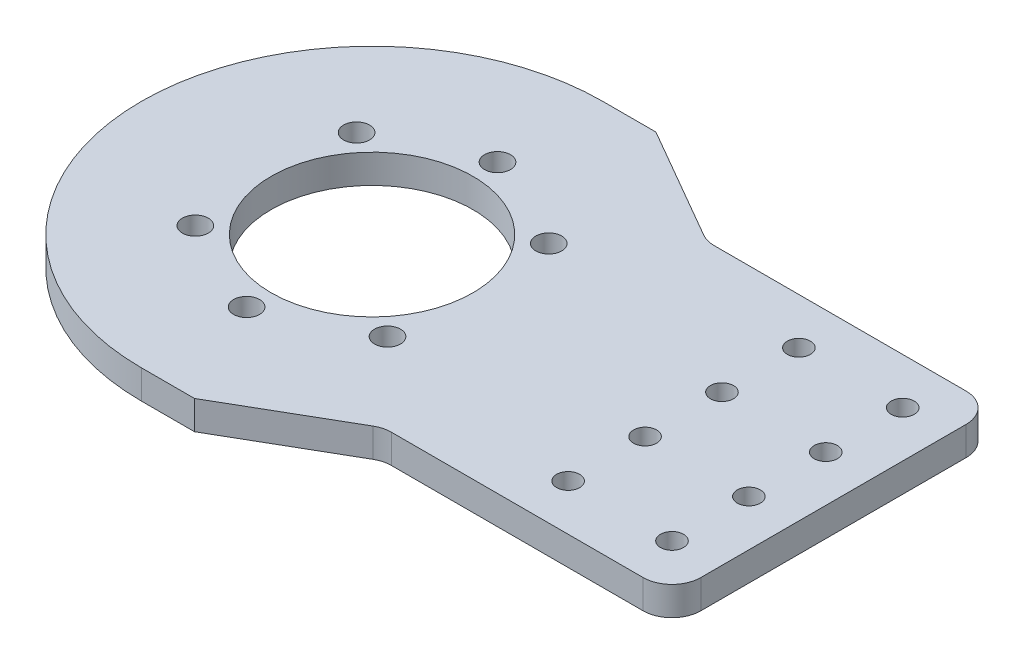
from build123d import *

# Parameters (mm, degrees)
SKETCH_1_W          = 270
SKETCH_1_H          = 5
EXTRUDE_1_DEPTH     = 95
SKETCH_2_R          = 2.25
SKETCH_2_R_2        = 17.5
CUT_EXTRUDE_1_DEPTH = 10
SKETCH_3_W          = 70
SKETCH_3_H          = 20
CUT_EXTRUDE_2_DEPTH = 10
SKETCH_6_W          = 219.864116777
SKETCH_6_H          = 129.686347052
CUT_EXTRUDE_5_DEPTH = 10
SKETCH_7_W          = 55.982845341
SKETCH_7_H          = 55
EXTRUDE_1_2_DEPTH   = 5
SKETCH_9_R          = 2
CUT_EXTRUDE_6_DEPTH = 5
FILLET_1_R          = 5
CUT_EXTRUDE_START   = -5
CUT_EXTRUDE_7_DEPTH = 5
FILLET_2_R          = 5


with BuildPart() as part:
    # 草图1 → Extrude 1 (new body)
    with BuildSketch(Plane.XY):
        with Locations((-135, -2.5)):
            Rectangle(SKETCH_1_W, SKETCH_1_H)
    extrude(amount=EXTRUDE_1_DEPTH)

    # 草图2 → 切除-拉伸1 (cut)
    with BuildSketch(Plane(origin=(0, 0, 0), x_dir=(1, 0, 0), z_dir=(0, 1, 0))):
        with Locations(Location((-246, -25.75, 0), (0, 0, 270))):
            Circle(SKETCH_2_R)
        with Locations(Location((-229.338533362, -33.519369489, 0), (0, 0, 270))):
            Circle(SKETCH_2_R)
        with Locations(Location((-262.661466638, -33.519369489, 0), (0, 0, 270))):
            Circle(SKETCH_2_R)
        with Locations(Location((-262.661466638, -61.480630511, 0), (0, 0, 270))):
            Circle(SKETCH_2_R)
        with Locations(Location((-246, -69.25, 0), (0, 0, 270))):
            Circle(SKETCH_2_R)
        with Locations(Location((-229.338533362, -61.480630511, 0), (0, 0, 270))):
            Circle(SKETCH_2_R)
        with Locations(Location((-246, -47.5, 0), (0, 0, 270))):
            Circle(SKETCH_2_R_2)
    extrude(amount=-CUT_EXTRUDE_1_DEPTH, mode=Mode.SUBTRACT)

    # 草图3 → 切除-拉伸2 (cut)
    with BuildSketch(Plane(origin=(0, 0, 0), x_dir=(1, 0, 0), z_dir=(0, 1, 0))):
        with Locations((-235, -85)):
            Rectangle(SKETCH_3_W, SKETCH_3_H)
        with Locations((-235, -10)):
            Rectangle(SKETCH_3_W, SKETCH_3_H)
        with BuildLine():
            Line((-190, -10), (-190, -34.757359313))
            ThreePointArc((-190, -34.757359313), (-188.148050297, -37.52899791), (-184.878679656, -36.878679656))
            Line((-184.878679656, -36.878679656), (-160.121320344, -12.121320344))
            ThreePointArc((-160.121320344, -12.121320344), (-159.47100209, -8.851949703), (-162.242640687, -7))
            Line((-162.242640687, -7), (-187, -7))
            ThreePointArc((-187, -7), (-189.121320344, -7.878679656), (-190, -10))
        make_face()
        with BuildLine():
            Line((-154.121320344, -12.121320344), (-178.878679656, -36.878679656))
            ThreePointArc((-178.878679656, -36.878679656), (-179.52899791, -40.148050297), (-176.757359313, -42))
            Line((-176.757359313, -42), (-152, -42))
            ThreePointArc((-152, -42), (-149.878679656, -41.121320344), (-149, -39))
            Line((-149, -39), (-149, -14.242640687))
            ThreePointArc((-149, -14.242640687), (-150.851949703, -11.47100209), (-154.121320344, -12.121320344))
        make_face()
        with BuildLine():
            Line((-112.242640687, -7), (-137, -7))
            ThreePointArc((-137, -7), (-139.121320344, -7.878679656), (-140, -10))
            Line((-140, -10), (-140, -34.757359313))
            ThreePointArc((-140, -34.757359313), (-138.148050297, -37.52899791), (-134.878679656, -36.878679656))
            Line((-134.878679656, -36.878679656), (-110.121320344, -12.121320344))
            ThreePointArc((-110.121320344, -12.121320344), (-109.47100209, -8.851949703), (-112.242640687, -7))
        make_face()
        with BuildLine():
            Line((-99, -39), (-99, -14.242640687))
            ThreePointArc((-99, -14.242640687), (-100.851949703, -11.47100209), (-104.121320344, -12.121320344))
            Line((-104.121320344, -12.121320344), (-128.878679656, -36.878679656))
            ThreePointArc((-128.878679656, -36.878679656), (-129.52899791, -40.148050297), (-126.757359313, -42))
            Line((-126.757359313, -42), (-102, -42))
            ThreePointArc((-102, -42), (-99.878679656, -41.121320344), (-99, -39))
        make_face()
        with BuildLine():
            Line((-112.242640687, -52), (-137, -52))
            ThreePointArc((-137, -52), (-139.121320344, -52.878679656), (-140, -55))
            Line((-140, -55), (-140, -79.757359313))
            ThreePointArc((-140, -79.757359313), (-138.148050297, -82.52899791), (-134.878679656, -81.878679656))
            Line((-134.878679656, -81.878679656), (-110.121320344, -57.121320344))
            ThreePointArc((-110.121320344, -57.121320344), (-109.47100209, -53.851949703), (-112.242640687, -52))
        make_face()
        with BuildLine():
            Line((-99, -84), (-99, -59.242640687))
            ThreePointArc((-99, -59.242640687), (-100.851949703, -56.47100209), (-104.121320344, -57.121320344))
            Line((-104.121320344, -57.121320344), (-128.878679656, -81.878679656))
            ThreePointArc((-128.878679656, -81.878679656), (-129.52899791, -85.148050297), (-126.757359313, -87))
            Line((-126.757359313, -87), (-102, -87))
            ThreePointArc((-102, -87), (-99.878679656, -86.121320344), (-99, -84))
        make_face()
        with BuildLine():
            Line((-162.242640687, -52), (-187, -52))
            ThreePointArc((-187, -52), (-189.121320344, -52.878679656), (-190, -55))
            Line((-190, -55), (-190, -79.757359313))
            ThreePointArc((-190, -79.757359313), (-188.148050297, -82.52899791), (-184.878679656, -81.878679656))
            Line((-184.878679656, -81.878679656), (-160.121320344, -57.121320344))
            ThreePointArc((-160.121320344, -57.121320344), (-159.47100209, -53.851949703), (-162.242640687, -52))
        make_face()
        with BuildLine():
            Line((-149, -84), (-149, -59.242640687))
            ThreePointArc((-149, -59.242640687), (-150.851949703, -56.47100209), (-154.121320344, -57.121320344))
            Line((-154.121320344, -57.121320344), (-178.878679656, -81.878679656))
            ThreePointArc((-178.878679656, -81.878679656), (-179.52899791, -85.148050297), (-176.757359313, -87))
            Line((-176.757359313, -87), (-152, -87))
            ThreePointArc((-152, -87), (-149.878679656, -86.121320344), (-149, -84))
        make_face()
        with BuildLine():
            Line((-62.242640687, -7), (-87, -7))
            ThreePointArc((-87, -7), (-89.121320344, -7.878679656), (-90, -10))
            Line((-90, -10), (-90, -34.757359313))
            ThreePointArc((-90, -34.757359313), (-88.148050297, -37.52899791), (-84.878679656, -36.878679656))
            Line((-84.878679656, -36.878679656), (-60.121320344, -12.121320344))
            ThreePointArc((-60.121320344, -12.121320344), (-59.47100209, -8.851949703), (-62.242640687, -7))
        make_face()
        with BuildLine():
            Line((-49, -39), (-49, -14.242640687))
            ThreePointArc((-49, -14.242640687), (-50.851949703, -11.47100209), (-54.121320344, -12.121320344))
            Line((-54.121320344, -12.121320344), (-78.878679656, -36.878679656))
            ThreePointArc((-78.878679656, -36.878679656), (-79.52899791, -40.148050297), (-76.757359313, -42))
            Line((-76.757359313, -42), (-52, -42))
            ThreePointArc((-52, -42), (-49.878679656, -41.121320344), (-49, -39))
        make_face()
        with BuildLine():
            Line((-62.242640687, -52), (-87, -52))
            ThreePointArc((-87, -52), (-89.121320344, -52.878679656), (-90, -55))
            Line((-90, -55), (-90, -79.757359313))
            ThreePointArc((-90, -79.757359313), (-88.148050297, -82.52899791), (-84.878679656, -81.878679656))
            Line((-84.878679656, -81.878679656), (-60.121320344, -57.121320344))
            ThreePointArc((-60.121320344, -57.121320344), (-59.47100209, -53.851949703), (-62.242640687, -52))
        make_face()
        with BuildLine():
            Line((-49, -84), (-49, -59.242640687))
            ThreePointArc((-49, -59.242640687), (-50.851949703, -56.47100209), (-54.121320344, -57.121320344))
            Line((-54.121320344, -57.121320344), (-78.878679656, -81.878679656))
            ThreePointArc((-78.878679656, -81.878679656), (-79.52899791, -85.148050297), (-76.757359313, -87))
            Line((-76.757359313, -87), (-52, -87))
            ThreePointArc((-52, -87), (-49.878679656, -86.121320344), (-49, -84))
        make_face()
    extrude(amount=-CUT_EXTRUDE_2_DEPTH, mode=Mode.SUBTRACT)

    # 草图6 → 切除-拉伸5 (cut)
    with BuildSketch(Plane(origin=(0, 0, 0), x_dir=(1, 0, 0), z_dir=(0, 1, 0))):
        with Locations((-104.085096271, -53.191913683)):
            Rectangle(SKETCH_6_W, SKETCH_6_H)
    extrude(amount=-CUT_EXTRUDE_5_DEPTH, mode=Mode.SUBTRACT)

    # 草图7 → Extrude 1 2 (add)
    with BuildSketch(Plane(origin=(0, 0, 0), x_dir=(1, 0, 0), z_dir=(0, 1, 0))):
        with BuildLine():
            Line((-246, -7.5), (-166, -7.5))
            Line((-166, -7.5), (-166, -87.5))
            Line((-166, -87.5), (-246, -87.5))
            ThreePointArc((-246, -87.5), (-286, -47.5), (-246, -7.5))
        make_face()
        with Locations((-242.008577329, -47.5)):
            Rectangle(SKETCH_7_W, SKETCH_7_H, mode=Mode.SUBTRACT)
    extrude(amount=-EXTRUDE_1_2_DEPTH)

    # 草图9 → 切除-拉伸6 (cut)
    with BuildSketch(Plane(origin=(0, 0, 0), x_dir=(1, 0, 0), z_dir=(0, 1, 0))):
        with Locations(Location((-192, -27.5, 0), (0, 0, 270))):
            Circle(SKETCH_9_R)
        with Locations(Location((-174, -27.5, 0), (0, 0, 270))):
            Circle(SKETCH_9_R)
        with Locations(Location((-174, -40.833333333, 0), (0, 0, 270))):
            Circle(SKETCH_9_R)
        with Locations(Location((-174, -54.166666667, 0), (0, 0, 270))):
            Circle(SKETCH_9_R)
        with Locations(Location((-174, -67.5, 0), (0, 0, 270))):
            Circle(SKETCH_9_R)
        with Locations(Location((-192, -40.833333333, 0), (0, 0, 270))):
            Circle(SKETCH_9_R)
        with Locations(Location((-192, -54.166666667, 0), (0, 0, 270))):
            Circle(SKETCH_9_R)
        with Locations(Location((-192, -67.5, 0), (0, 0, 270))):
            Circle(SKETCH_9_R)
    extrude(amount=-CUT_EXTRUDE_6_DEPTH, mode=Mode.SUBTRACT)

    # 圆角1
    fillet_1_edges = [part.edges().sort_by_distance(p)[0] for p in [
        (-166, -2.5, 7.5),
        (-166, -2.5, 87.5),
    ]]
    fillet(fillet_1_edges, radius=FILLET_1_R)

    # 草图10 → 切除-拉伸7 (cut)
    with BuildSketch(Plane(origin=(0, 0, 0), x_dir=(1, 0, 0), z_dir=(0, 1, 0)).offset(CUT_EXTRUDE_START)):
        with BuildLine():
            Line((-171, -7.5), (-236.784609691, -7.5))
            Line((-236.784609691, -7.5), (-216, -19.5))
            Line((-216, -19.5), (-166, -19.5))
            Line((-166, -19.5), (-166, -12.5))
            ThreePointArc((-166, -12.5), (-167.464466094, -8.964466094), (-171, -7.5))
        make_face()
        with BuildLine():
            Line((-166, -82.5), (-166, -75.5))
            Line((-166, -75.5), (-216, -75.5))
            Line((-216, -75.5), (-236.784609691, -87.5))
            Line((-236.784609691, -87.5), (-171, -87.5))
            ThreePointArc((-171, -87.5), (-167.464466094, -86.035533906), (-166, -82.5))
        make_face()
    extrude(amount=CUT_EXTRUDE_7_DEPTH, mode=Mode.SUBTRACT)

    # 圆角2
    fillet_2_edges = [part.edges().sort_by_distance(p)[0] for p in [
        (-216, -2.5, 19.5),
        (-166, -2.5, 19.5),
        (-216, -2.5, 75.5),
        (-166, -2.5, 75.5),
    ]]
    fillet(fillet_2_edges, radius=FILLET_2_R)


solid = part.part
